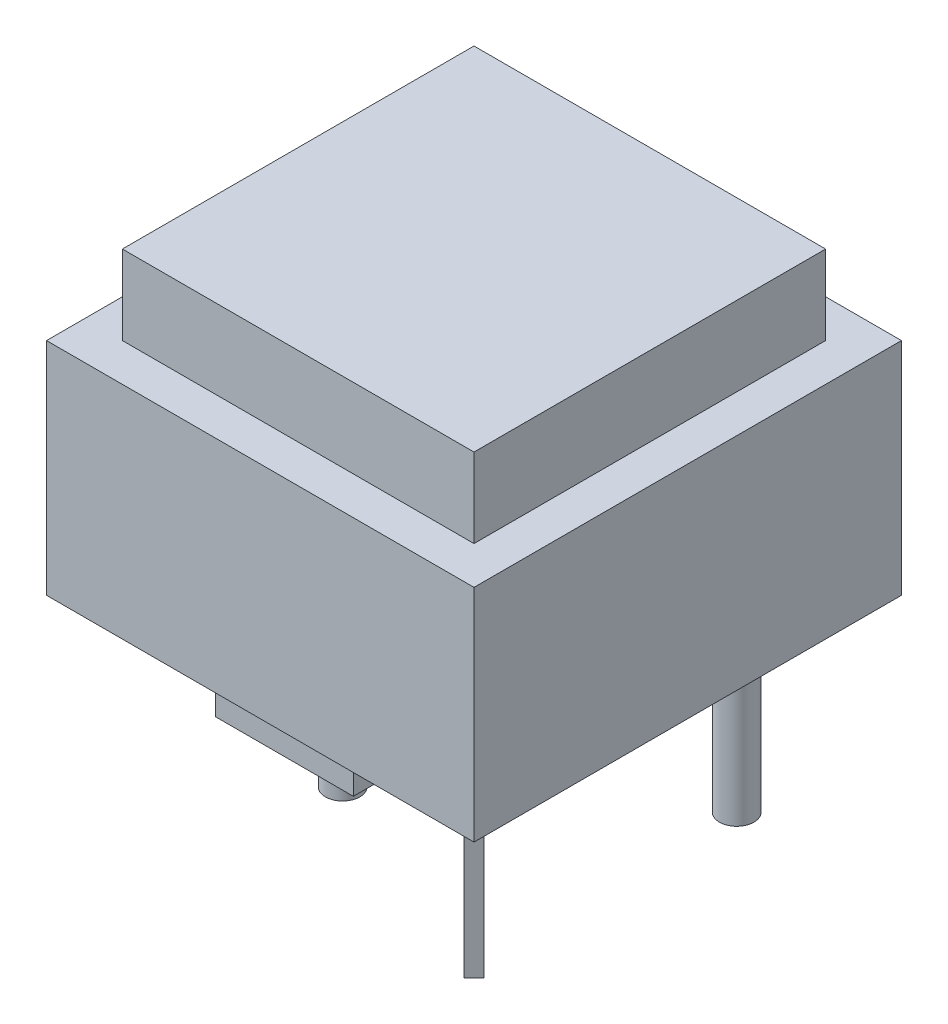
from build123d import *

# Parameters (mm, degrees)
SKETCH1_W           = 12.4
SKETCH1_H           = 12.4
BOSS_EXTRUDE1_DEPTH = 6.4
SKETCH2_W           = 10.2
SKETCH2_H           = 10.2
BOSS_EXTRUDE2_DEPTH = 2.3
SKETCH3_R           = 0.5
BOSS_EXTRUDE3_DEPTH = 5.45
SKETCH4_W           = 4
SKETCH4_H           = 1
BOSS_EXTRUDE4_DEPTH = 1.3


with BuildPart() as part:
    # Sketch1 → Boss-Extrude1 (new body)
    with BuildSketch(Plane(origin=(0, 0, 0), x_dir=(1, 0, 0), z_dir=(0, 1, 0))):
        Rectangle(SKETCH1_W, SKETCH1_H)
    extrude(amount=-BOSS_EXTRUDE1_DEPTH)

    # Sketch2 → Boss-Extrude2 (add)
    with BuildSketch(Plane(origin=(0, 0, 0), x_dir=(1, 0, 0), z_dir=(0, 1, 0))):
        Rectangle(SKETCH2_W, SKETCH2_H)
    extrude(amount=BOSS_EXTRUDE2_DEPTH)

    # Sketch3 → Boss-Extrude3 (add)
    with BuildSketch(Plane.XZ.offset(6.4)):
        with Locations(Location((-2.54, 1.27, 0), (0, 0, 270))):
            Circle(SKETCH3_R)
        Polygon((4.304974747, 4.022132034), (4.022132034, 4.304974747), (3.668578644, 3.951421356), (3.951421356, 3.668578644), align=None)
        Polygon((3.951421356, 3.668578644), (3.668578644, 3.951421356), (3.315025253, 3.597867966), (3.597867966, 3.315025253), align=None)
        with Locations(Location((3.81, -3.81, 0), (0, 0, 270))):
            Circle(SKETCH3_R)
        Polygon((-0.775025253, -1.482132034), (-1.128578644, -1.128578644), (-1.411421356, -1.411421356), (-1.057867966, -1.764974747), align=None)
        Polygon((-1.128578644, -1.128578644), (-1.482132034, -0.775025253), (-1.764974747, -1.057867966), (-1.411421356, -1.411421356), align=None)
    extrude(amount=BOSS_EXTRUDE3_DEPTH)

    # Sketch4 → Boss-Extrude4 (add)
    with BuildSketch(Plane.XZ.offset(6.4)):
        with Locations((0, -5)):
            Rectangle(SKETCH4_W, SKETCH4_H)
        with Locations((0, 5)):
            Rectangle(SKETCH4_W, SKETCH4_H)
    extrude(amount=BOSS_EXTRUDE4_DEPTH)


solid = part.part
